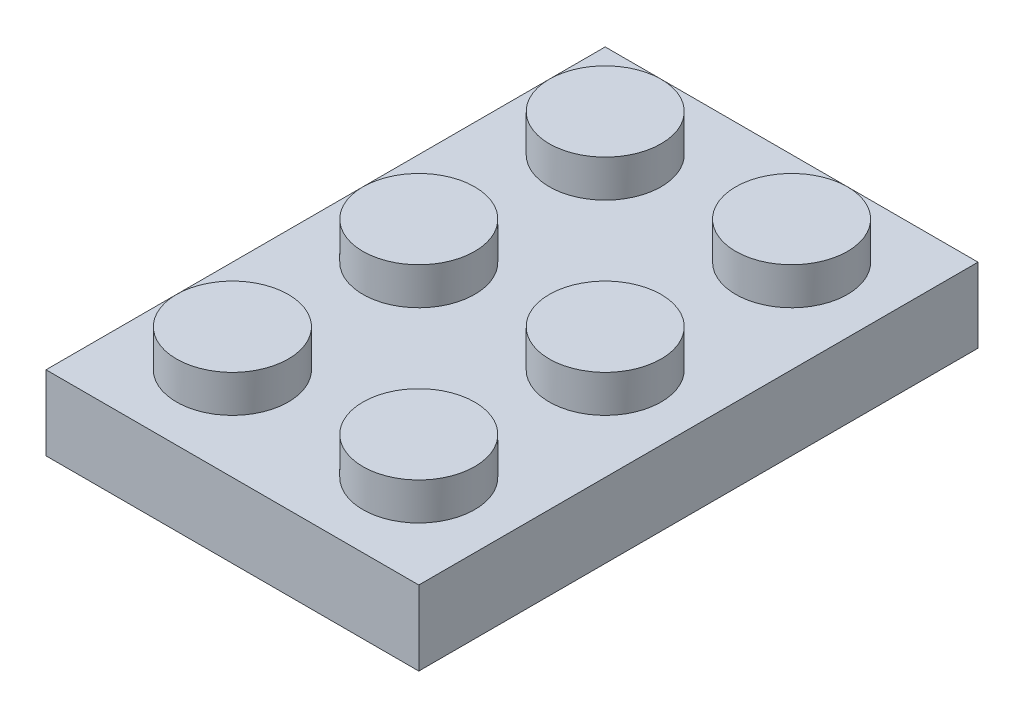
from build123d import *

# Parameters (mm, degrees)
SKETCH1_W            = 16
SKETCH1_H            = 24
BOSS_EXTRUDE1_DEPTH  = 3.2
SKETCH2_R            = 2.4
BOSS_EXTRUDE2_DEPTH  = 1.6
LPATTERN1_COUNT      = 2
LPATTERN1_PITCH      = 8
LPATTERN1_COUNT_DIR2 = 3
LPATTERN1_PITCH_DIR2 = 8
SHELL1_T             = -1.6


with BuildPart() as part:
    # Sketch1 → Boss-Extrude1 (new body)
    with BuildSketch(Plane(origin=(0, 0, 0), x_dir=(1, 0, 0), z_dir=(0, 1, 0))):
        with Locations((8, 12)):
            Rectangle(SKETCH1_W, SKETCH1_H)
    extrude(amount=BOSS_EXTRUDE1_DEPTH)

    # Sketch2 → Boss-Extrude2 (add)
    with BuildSketch(Plane(origin=(0, 3.2, 0), x_dir=(1, 0, 0), z_dir=(0, 1, 0))):
        with Locations(Location((12, 4, 0), (0, 0, 90))):
            Circle(SKETCH2_R)
    boss_extrude2 = extrude(amount=BOSS_EXTRUDE2_DEPTH)

    # LPattern1: Boss-Extrude2 2 × 3
    with Locations(*[(-i * LPATTERN1_PITCH, 0, -j * LPATTERN1_PITCH_DIR2) for i in range(LPATTERN1_COUNT) for j in range(LPATTERN1_COUNT_DIR2) if (i, j) != (0, 0)]):
        add(boss_extrude2)

    # Shell1
    shell1_openings = [part.faces().sort_by_distance(p)[0] for p in [
        (8, 0, -12),
    ]]
    offset(amount=SHELL1_T, openings=shell1_openings, kind=Kind.INTERSECTION)


solid = part.part
